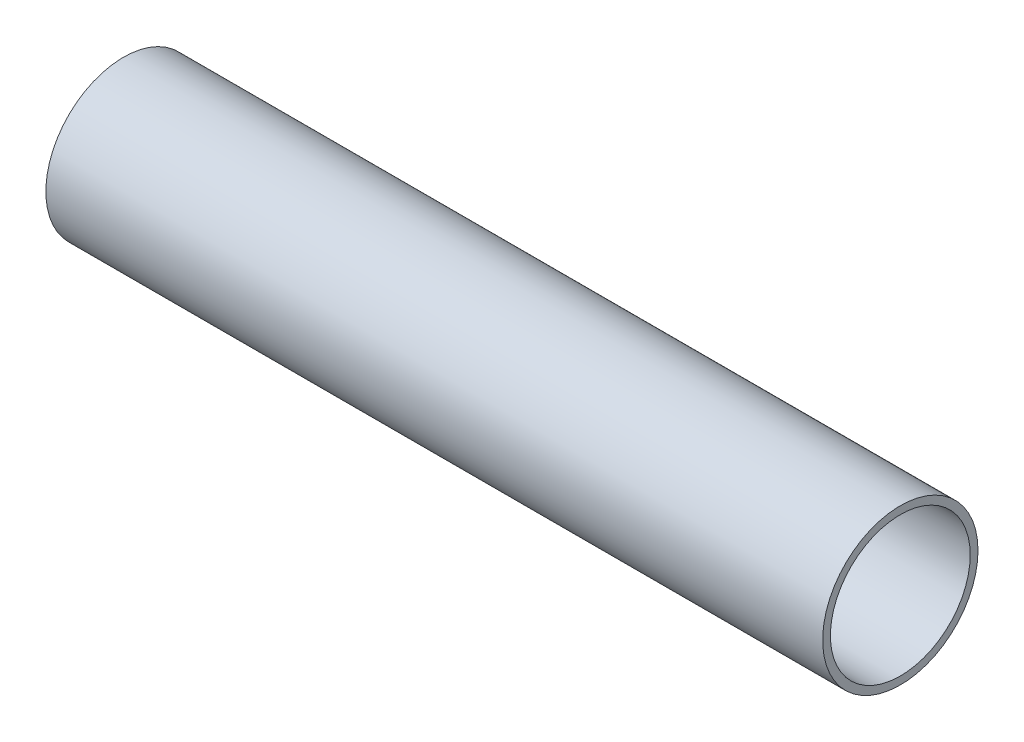
from build123d import *

# Parameters (mm, degrees)
SKETCH_1_R      = 20
SKETCH_1_R_2    = 18
EXTRUDE_1_DEPTH = 200


with BuildPart() as part:
    # 草图1 → 凸台-拉伸1 (new body)
    with BuildSketch(Plane(origin=(0, 0, 0), x_dir=(0, 0, -1), z_dir=(1, 0, 0))):
        Circle(SKETCH_1_R)
        Circle(SKETCH_1_R_2, mode=Mode.SUBTRACT)
    extrude(amount=EXTRUDE_1_DEPTH)


solid = part.part
